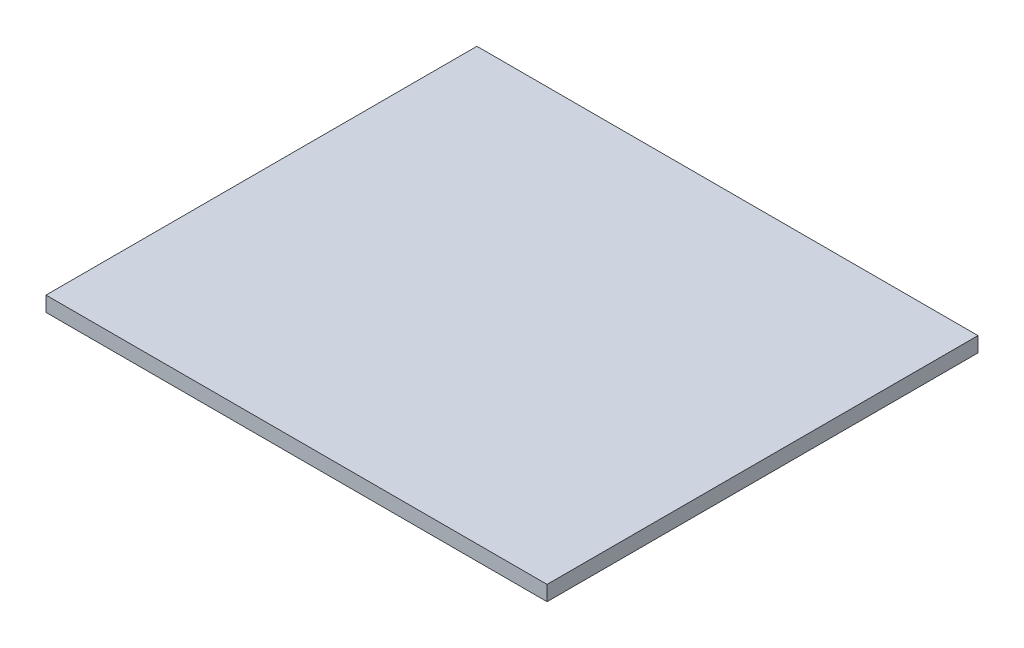
from build123d import *

# Parameters (mm, degrees)
SKETCH1_W           = 100
SKETCH1_H           = 86
BOSS_EXTRUDE1_DEPTH = 3


with BuildPart() as part:
    # Sketch1 → Boss-Extrude1 (new body)
    with BuildSketch(Plane(origin=(0, 0, 0), x_dir=(1, 0, 0), z_dir=(0, 1, 0))):
        Rectangle(SKETCH1_W, SKETCH1_H)
    extrude(amount=BOSS_EXTRUDE1_DEPTH)


solid = part.part
